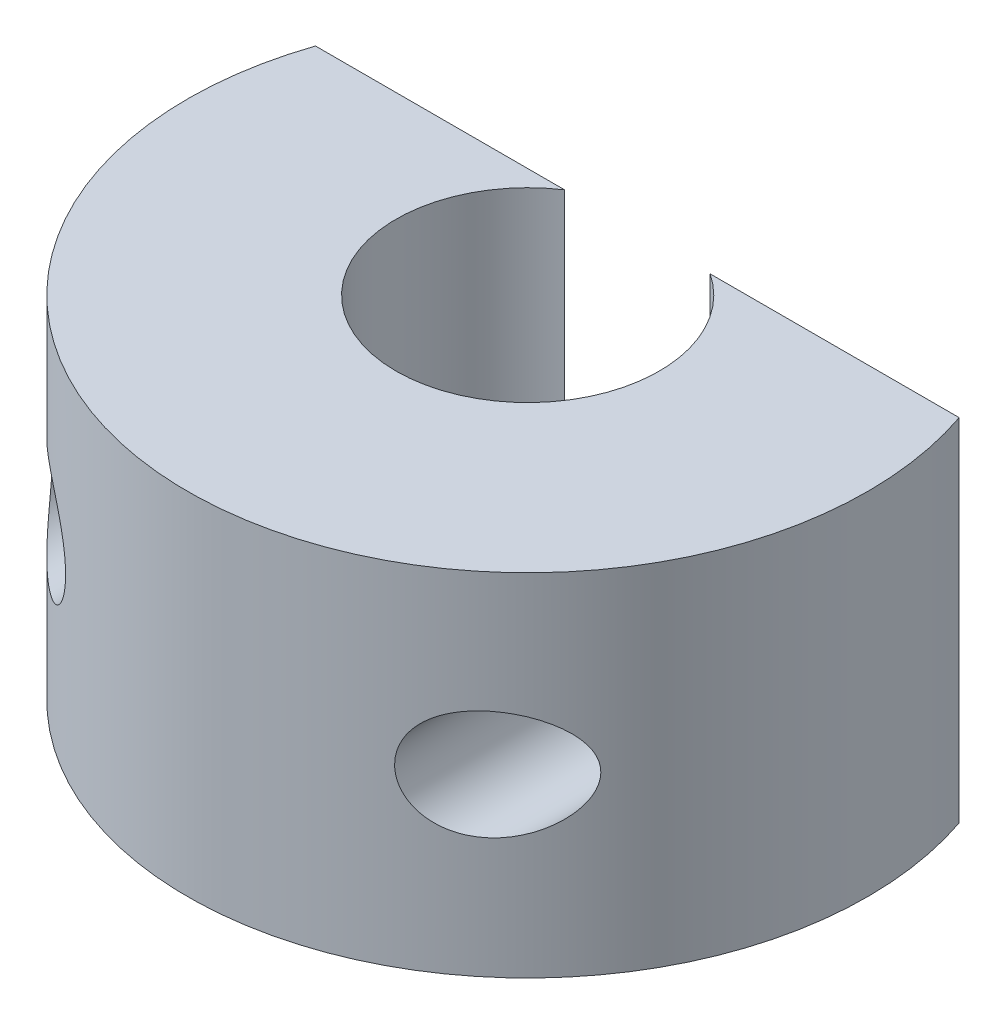
from build123d import *

# Parameters (mm, degrees)
BOSS_EXTRU_1_DEPTH      = 4
ESQUISSE2_R             = 1.25
ENL_V_MAT_EXTRU_1_DEPTH = 14.458268834


with BuildPart() as part:
    # Esquisse1 → Boss.-Extru.1 (new, symmetric)
    with BuildSketch(Plane(origin=(0, 0, 0), x_dir=(1, 0, 0), z_dir=(0, 1, 0))):
        with BuildLine():
            Line((-7.335700376, 2.5), (-1.658312395, 2.5))
            ThreePointArc((-1.658312395, 2.5), (0, -3), (1.658312395, 2.5))
            Line((1.658312395, 2.5), (7.335700376, 2.5))
            ThreePointArc((7.335700376, 2.5), (0, -7.75), (-7.335700376, 2.5))
        make_face()
    extrude(amount=BOSS_EXTRU_1_DEPTH, both=True)

    # Esquisse2 → Enlèv. mat.-Extru.1 (cut, through all)
    with BuildSketch(Plane(origin=(0, 0, -2.5), x_dir=(-1, 0, 0), z_dir=(0, 0, -1))):
        with Locations((-5, 0)):
            Circle(ESQUISSE2_R)
        with Locations((5, 0)):
            Circle(ESQUISSE2_R)
    extrude(amount=-ENL_V_MAT_EXTRU_1_DEPTH, mode=Mode.SUBTRACT)


solid = part.part
